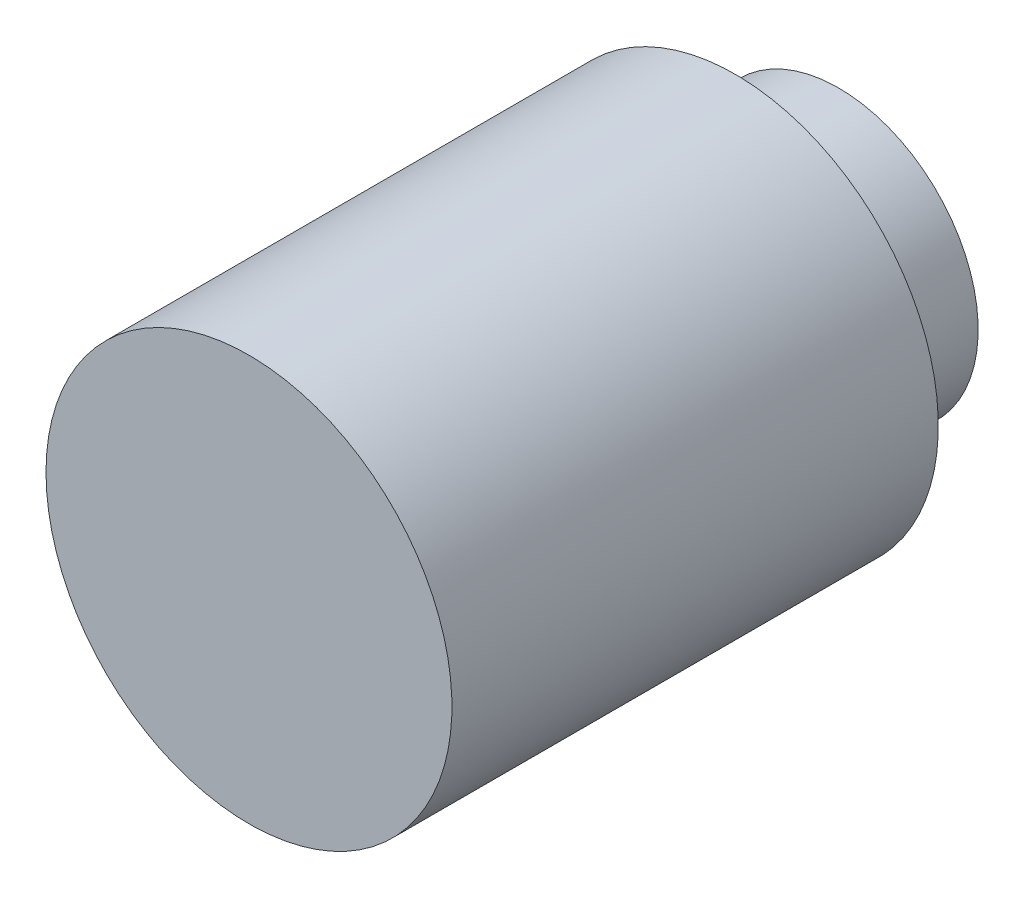
from build123d import *


with BuildPart() as part:
    # Sketch1 → Revolve1 (revolve)
    with BuildSketch(Plane(origin=(0, 0, 0), x_dir=(1, 0, 0), z_dir=(0, 1, 0)), mode=Mode.PRIVATE) as revolve1_sk:
        Polygon((0, 0), (6.88975, 0), (6.88975, 16.51), (4.7371, 16.51), (4.7371, 20.0152), (0, 20.0152), align=None)
    revolve(revolve1_sk.sketch.rotate(Axis((0, 0, -20.0152), (0, 0, 1)), 180), axis=Axis((0, 0, -20.0152), (0, 0, 1)))


solid = part.part
